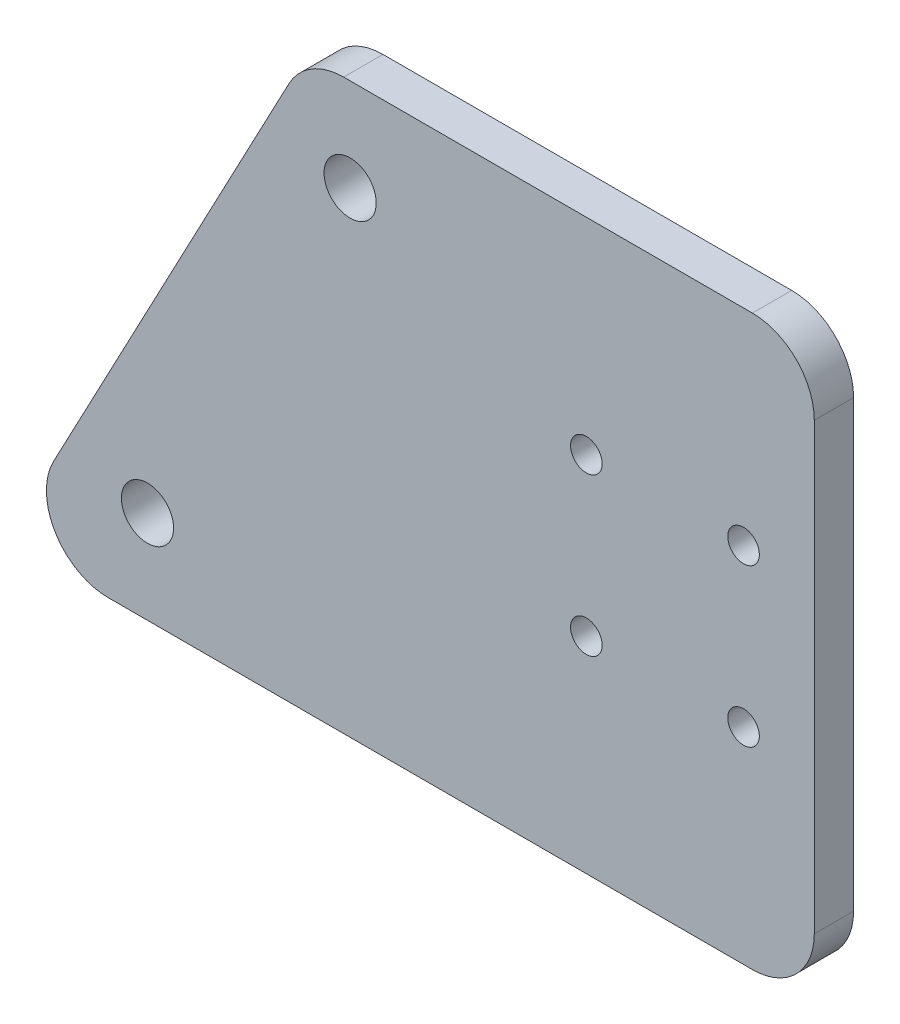
from build123d import *

# Parameters (mm, degrees)
SKETCH1_R           = 4.2164
BOSS_EXTRUDE1_DEPTH = 6.35
SKETCH2_R           = 2.5527
CUT_EXTRUDE1_DEPTH  = 6.35
FILLET1_R           = 10


with BuildPart() as part:
    # Sketch1 → Boss-Extrude1 (new body)
    with BuildSketch(Plane.XY):
        Polygon((267.938493178, -135), (219.318011435, -226.869730158), (350, -226.869730158), (350, -135), align=None)
        with Locations((275, -150)):
            Circle(SKETCH1_R, mode=Mode.SUBTRACT)
        with Locations((242.256504613, -211.869730158)):
            Circle(SKETCH1_R, mode=Mode.SUBTRACT)
    extrude(amount=BOSS_EXTRUDE1_DEPTH)

    # Sketch2 → Cut-Extrude1 (cut)
    with BuildSketch(Plane.XY.offset(6.35)):
        with Locations((313.17, -168.234865079)):
            Circle(SKETCH2_R)
        with Locations((338.57, -168.234865079)):
            Circle(SKETCH2_R)
        with Locations((313.17, -193.634865079)):
            Circle(SKETCH2_R)
        with Locations((338.57, -193.634865079)):
            Circle(SKETCH2_R)
    extrude(amount=-CUT_EXTRUDE1_DEPTH, mode=Mode.SUBTRACT)

    # Fillet1
    fillet1_edges = [part.edges().sort_by_distance(p)[0] for p in [
        (267.938493178, -135, 3.175),
        (219.318011435, -226.869730158, 3.175),
        (350, -226.869730158, 3.175),
        (350, -135, 3.175),
    ]]
    fillet(fillet1_edges, radius=FILLET1_R)


solid = part.part
